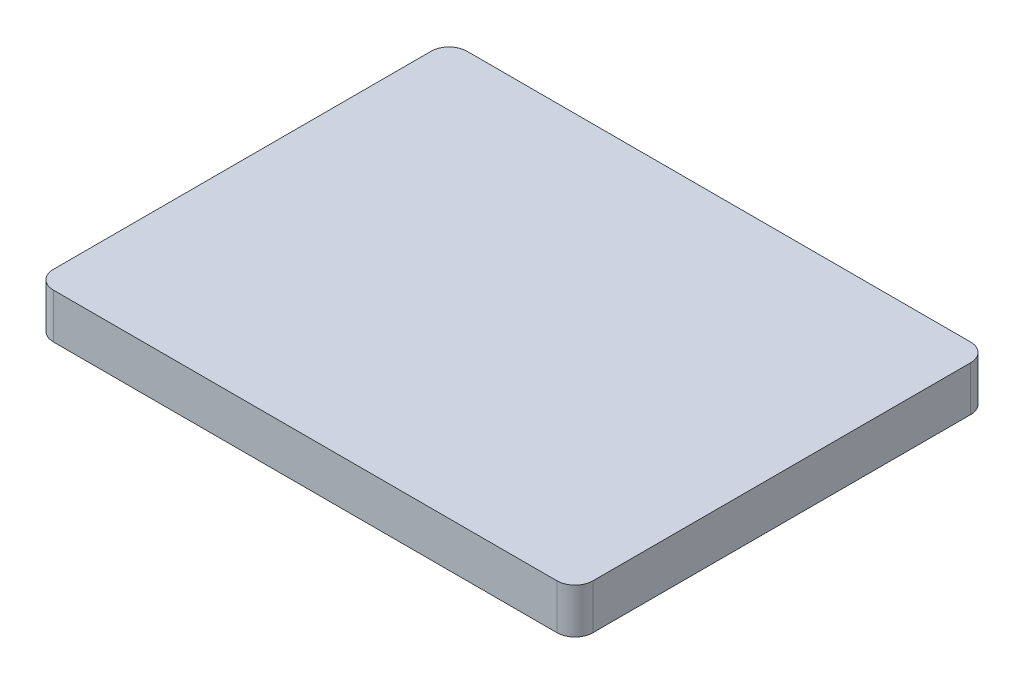
from build123d import *

# Parameters (mm, degrees)
SKETCH1_W           = 300
SKETCH1_H           = 230
BOSS_EXTRUDE1_DEPTH = 25
FILLET1_R           = 10


with BuildPart() as part:
    # Sketch1 → Boss-Extrude1 (new body)
    with BuildSketch(Plane(origin=(0, 0, 0), x_dir=(1, 0, 0), z_dir=(0, 1, 0))):
        Rectangle(SKETCH1_W, SKETCH1_H)
    extrude(amount=BOSS_EXTRUDE1_DEPTH)

    # Fillet1
    fillet1_edges = [part.edges().sort_by_distance(p)[0] for p in [
        (-150, 12.5, -115),
        (150, 12.5, -115),
        (150, 12.5, 115),
        (-150, 12.5, 115),
    ]]
    fillet(fillet1_edges, radius=FILLET1_R)


solid = part.part
